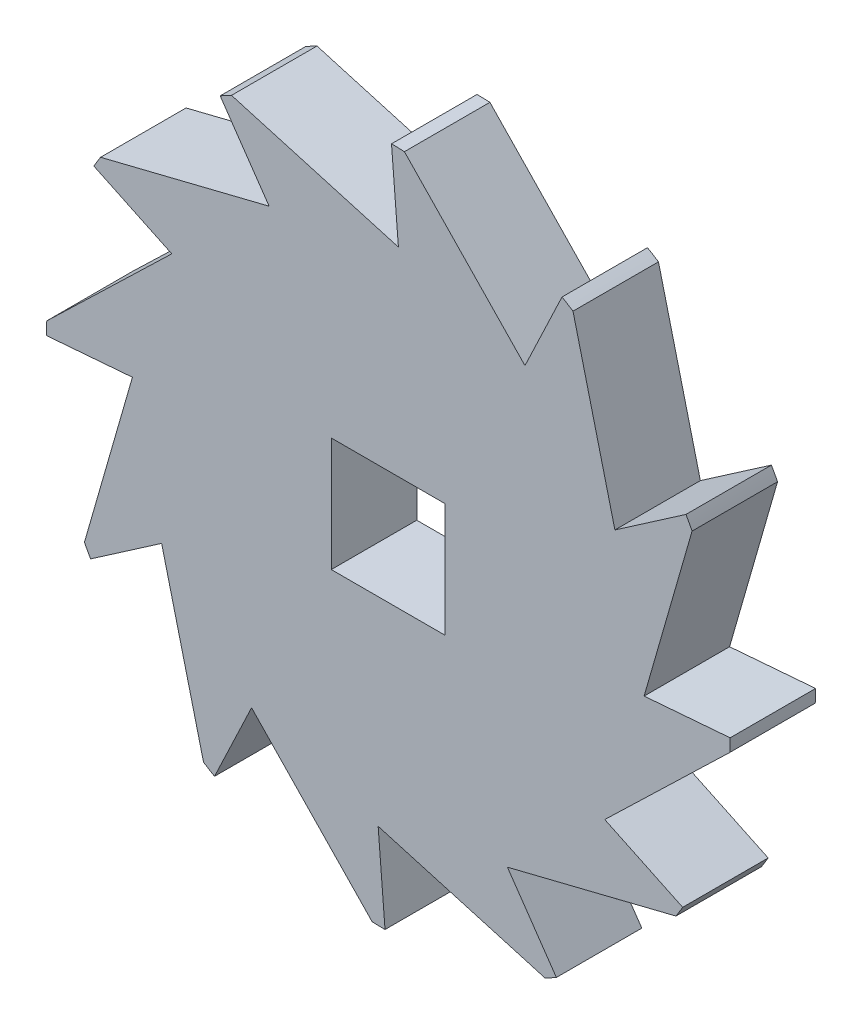
from build123d import *

# Parameters (mm, degrees)
SCHIZZO2_R                   = 30
ESTRUSIONE_ESTRUSIONE1_DEPTH = 7.5
SCHIZZO3_W                   = 10
SCHIZZO3_H                   = 10
TAGLIO_ESTRUSIONE1_DEPTH     = 44.084219849
TAGLIO_ESTRUSIONE2_DEPTH     = 44.084219849


with BuildPart() as part:
    # Schizzo2 → Estrusione-Estrusione1 (new body)
    with BuildSketch(Plane.XY):
        Circle(SCHIZZO2_R)
    extrude(amount=ESTRUSIONE_ESTRUSIONE1_DEPTH)

    # Schizzo3 → Taglio-Estrusione1 (cut, through all)
    with BuildSketch(Plane(origin=(0, 0, 0), x_dir=(-1, 0, 0), z_dir=(0, 0, -1))):
        Rectangle(SCHIZZO3_W, SCHIZZO3_H)
    extrude(amount=-TAGLIO_ESTRUSIONE1_DEPTH, mode=Mode.SUBTRACT)

    # Schizzo4 → Taglio-Estrusione2 (cut, through all)
    with BuildSketch(Plane(origin=(0, 0, 0), x_dir=(-1, 0, 0), z_dir=(0, 0, -1))):
        with BuildLine():
            Line((-0.285302534, 29.998643344), (-0.89, 22.45))
            Line((-0.89, 22.45), (13.755471769, 26.660588823))
            ThreePointArc((13.755471769, 26.660588823), (6.938805142, 29.186520574), (-0.285302534, 29.998643344))
        make_face()
        with BuildLine():
            Line((10.454237391, 19.887270315), (25.242882405, 16.211011316))
            ThreePointArc((25.242882405, 16.211011316), (20.602441812, 21.806865694), (14.75224243, 26.122238482))
            Line((14.75224243, 26.122238482), (10.454237391, 19.887270315))
        make_face()
        with BuildLine():
            Line((18.997270315, 11.995762609), (29.966483085, 1.417706418))
            ThreePointArc((29.966483085, 1.417706418), (28.745670836, 8.584078762), (25.836935948, 15.246400914))
            Line((25.836935948, 15.246400914), (18.997270315, 11.995762609))
        make_face()
        with BuildLine():
            Line((22.45, 0.89), (26.660588823, -13.755471769))
            ThreePointArc((26.660588823, -13.755471769), (29.186520574, -6.938805142), (29.998643344, 0.285302534))
            Line((29.998643344, 0.285302534), (22.45, 0.89))
        make_face()
        with BuildLine():
            Line((19.887270315, -10.454237391), (16.211011316, -25.242882405))
            ThreePointArc((16.211011316, -25.242882405), (21.806865694, -20.602441812), (26.122238482, -14.75224243))
            Line((26.122238482, -14.75224243), (19.887270315, -10.454237391))
        make_face()
        with BuildLine():
            Line((11.995762609, -18.997270315), (1.417706418, -29.966483085))
            ThreePointArc((1.417706418, -29.966483085), (8.584078762, -28.745670836), (15.246400914, -25.836935948))
            Line((15.246400914, -25.836935948), (11.995762609, -18.997270315))
        make_face()
        with BuildLine():
            Line((0.89, -22.45), (-13.755471769, -26.660588823))
            ThreePointArc((-13.755471769, -26.660588823), (-6.938805142, -29.186520574), (0.285302534, -29.998643344))
            Line((0.285302534, -29.998643344), (0.89, -22.45))
        make_face()
        with BuildLine():
            Line((-10.454237391, -19.887270315), (-25.242882405, -16.211011316))
            ThreePointArc((-25.242882405, -16.211011316), (-20.602441812, -21.806865694), (-14.75224243, -26.122238482))
            Line((-14.75224243, -26.122238482), (-10.454237391, -19.887270315))
        make_face()
        with BuildLine():
            Line((-18.997270315, -11.995762609), (-29.966483085, -1.417706418))
            ThreePointArc((-29.966483085, -1.417706418), (-28.745670836, -8.584078762), (-25.836935948, -15.246400914))
            Line((-25.836935948, -15.246400914), (-18.997270315, -11.995762609))
        make_face()
        with BuildLine():
            Line((-22.45, -0.89), (-26.660588823, 13.755471769))
            ThreePointArc((-26.660588823, 13.755471769), (-29.186520574, 6.938805142), (-29.998643344, -0.285302534))
            Line((-29.998643344, -0.285302534), (-22.45, -0.89))
        make_face()
        with BuildLine():
            Line((-19.887270315, 10.454237391), (-16.211011316, 25.242882405))
            ThreePointArc((-16.211011316, 25.242882405), (-21.806865694, 20.602441812), (-26.122238482, 14.75224243))
            Line((-26.122238482, 14.75224243), (-19.887270315, 10.454237391))
        make_face()
        with BuildLine():
            Line((-11.995762609, 18.997270315), (-1.417706418, 29.966483085))
            ThreePointArc((-1.417706418, 29.966483085), (-8.584078762, 28.745670836), (-15.246400914, 25.836935948))
            Line((-15.246400914, 25.836935948), (-11.995762609, 18.997270315))
        make_face()
    extrude(amount=-TAGLIO_ESTRUSIONE2_DEPTH, mode=Mode.SUBTRACT)


solid = part.part
